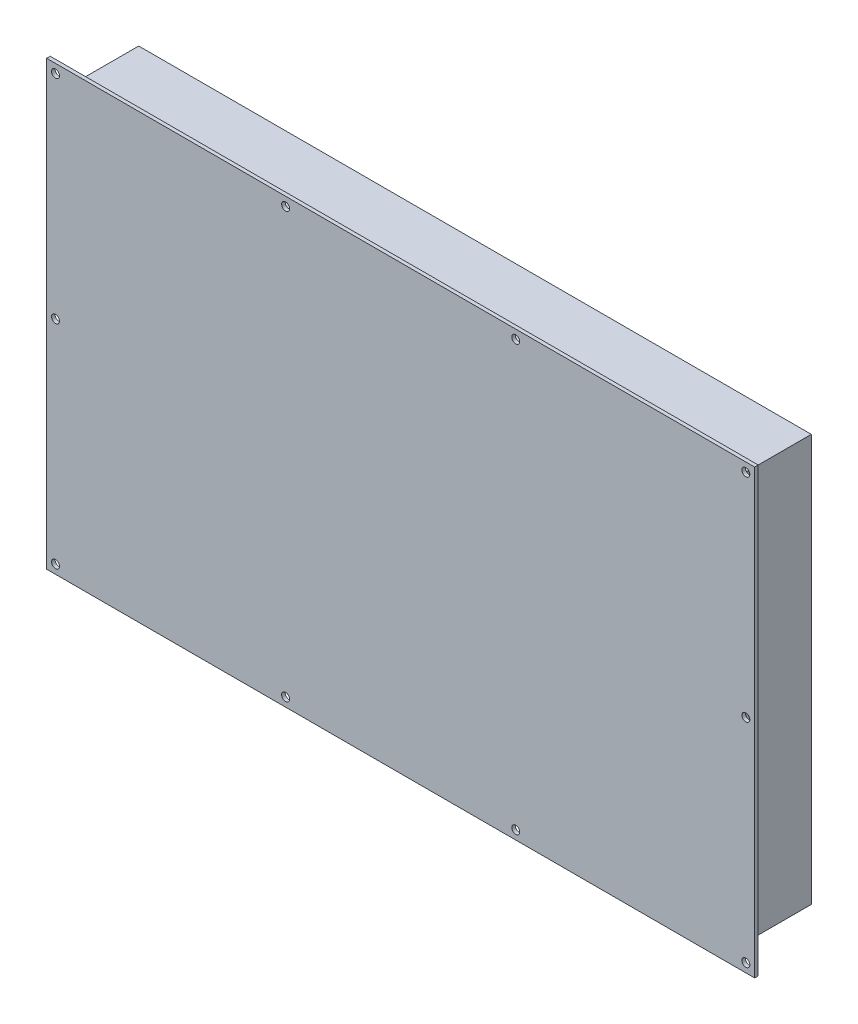
from build123d import *

# Parameters (mm, degrees)
IZIM1_W                     = 400
IZIM1_H                     = 250
Y_KSEKLIK_EKSTR_ZYON1_DEPTH = 2
KES_EKSTR_ZYON1_REACH       = 237.858
IZIM3_R                     = 2.25
IZIM4_W                     = 380
IZIM4_H                     = 230
Y_KSEKLIK_EKSTR_ZYON2_DEPTH = 40


with BuildPart() as part:
    # Çizim1 → Yükseklik-Ekstrüzyon1 (new body)
    with BuildSketch(Plane.XY):
        Rectangle(IZIM1_W, IZIM1_H)
    extrude(amount=Y_KSEKLIK_EKSTR_ZYON1_DEPTH)

    # Çizim3 → Kes-Ekstrüzyon1 (cut, up to next)
    with BuildSketch(Plane.XY.offset(2), mode=Mode.PRIVATE) as kes_ekstr_zyon1_sk1:
        with Locations((-195, 120)):
            Circle(IZIM3_R)
    kes_ekstr_zyon1_tool1 = extrude(kes_ekstr_zyon1_sk1.sketch, amount=-KES_EKSTR_ZYON1_REACH, mode=Mode.PRIVATE) & part.part
    # Çizim3 → Kes-Ekstrüzyon1 (cut, up to next)
    with BuildSketch(Plane.XY.offset(2), mode=Mode.PRIVATE) as kes_ekstr_zyon1_sk2:
        with Locations((-65, 120)):
            Circle(IZIM3_R)
    kes_ekstr_zyon1_tool2 = extrude(kes_ekstr_zyon1_sk2.sketch, amount=-KES_EKSTR_ZYON1_REACH, mode=Mode.PRIVATE) & part.part
    # Çizim3 → Kes-Ekstrüzyon1 (cut, up to next)
    with BuildSketch(Plane.XY.offset(2), mode=Mode.PRIVATE) as kes_ekstr_zyon1_sk3:
        with Locations((65, 120)):
            Circle(IZIM3_R)
    kes_ekstr_zyon1_tool3 = extrude(kes_ekstr_zyon1_sk3.sketch, amount=-KES_EKSTR_ZYON1_REACH, mode=Mode.PRIVATE) & part.part
    # Çizim3 → Kes-Ekstrüzyon1 (cut, up to next)
    with BuildSketch(Plane.XY.offset(2), mode=Mode.PRIVATE) as kes_ekstr_zyon1_sk4:
        with Locations((195, 120)):
            Circle(IZIM3_R)
    kes_ekstr_zyon1_tool4 = extrude(kes_ekstr_zyon1_sk4.sketch, amount=-KES_EKSTR_ZYON1_REACH, mode=Mode.PRIVATE) & part.part
    # Çizim3 → Kes-Ekstrüzyon1 (cut, up to next)
    with BuildSketch(Plane.XY.offset(2), mode=Mode.PRIVATE) as kes_ekstr_zyon1_sk5:
        with Locations(Location((-65, -120, 0), (0, 0, 180))):
            Circle(IZIM3_R)
    kes_ekstr_zyon1_tool5 = extrude(kes_ekstr_zyon1_sk5.sketch, amount=-KES_EKSTR_ZYON1_REACH, mode=Mode.PRIVATE) & part.part
    # Çizim3 → Kes-Ekstrüzyon1 (cut, up to next)
    with BuildSketch(Plane.XY.offset(2), mode=Mode.PRIVATE) as kes_ekstr_zyon1_sk6:
        with Locations(Location((65, -120, 0), (0, 0, 180))):
            Circle(IZIM3_R)
    kes_ekstr_zyon1_tool6 = extrude(kes_ekstr_zyon1_sk6.sketch, amount=-KES_EKSTR_ZYON1_REACH, mode=Mode.PRIVATE) & part.part
    # Çizim3 → Kes-Ekstrüzyon1 (cut, up to next)
    with BuildSketch(Plane.XY.offset(2), mode=Mode.PRIVATE) as kes_ekstr_zyon1_sk7:
        with Locations(Location((195, -120, 0), (0, 0, 180))):
            Circle(IZIM3_R)
    kes_ekstr_zyon1_tool7 = extrude(kes_ekstr_zyon1_sk7.sketch, amount=-KES_EKSTR_ZYON1_REACH, mode=Mode.PRIVATE) & part.part
    # Çizim3 → Kes-Ekstrüzyon1 (cut, up to next)
    with BuildSketch(Plane.XY.offset(2), mode=Mode.PRIVATE) as kes_ekstr_zyon1_sk8:
        with Locations(Location((-195, -120, 0), (0, 0, 180))):
            Circle(IZIM3_R)
    kes_ekstr_zyon1_tool8 = extrude(kes_ekstr_zyon1_sk8.sketch, amount=-KES_EKSTR_ZYON1_REACH, mode=Mode.PRIVATE) & part.part
    # Çizim3 → Kes-Ekstrüzyon1 (cut, up to next)
    with BuildSketch(Plane.XY.offset(2), mode=Mode.PRIVATE) as kes_ekstr_zyon1_sk9:
        with Locations(Location((-195, 0, 0), (0, 0, 180))):
            Circle(IZIM3_R)
    kes_ekstr_zyon1_tool9 = extrude(kes_ekstr_zyon1_sk9.sketch, amount=-KES_EKSTR_ZYON1_REACH, mode=Mode.PRIVATE) & part.part
    # Çizim3 → Kes-Ekstrüzyon1 (cut, up to next)
    with BuildSketch(Plane.XY.offset(2), mode=Mode.PRIVATE) as kes_ekstr_zyon1_sk10:
        with Locations(Location((195, 0, 0), (0, 0, 180))):
            Circle(IZIM3_R)
    kes_ekstr_zyon1_tool10 = extrude(kes_ekstr_zyon1_sk10.sketch, amount=-KES_EKSTR_ZYON1_REACH, mode=Mode.PRIVATE) & part.part
    add(kes_ekstr_zyon1_tool1.solids().sort_by_distance((-195, 120, 2))[0], mode=Mode.SUBTRACT)
    add(kes_ekstr_zyon1_tool2.solids().sort_by_distance((-65, 120, 2))[0], mode=Mode.SUBTRACT)
    add(kes_ekstr_zyon1_tool3.solids().sort_by_distance((65, 120, 2))[0], mode=Mode.SUBTRACT)
    add(kes_ekstr_zyon1_tool4.solids().sort_by_distance((195, 120, 2))[0], mode=Mode.SUBTRACT)
    add(kes_ekstr_zyon1_tool5.solids().sort_by_distance((-65, -120, 2))[0], mode=Mode.SUBTRACT)
    add(kes_ekstr_zyon1_tool6.solids().sort_by_distance((65, -120, 2))[0], mode=Mode.SUBTRACT)
    add(kes_ekstr_zyon1_tool7.solids().sort_by_distance((195, -120, 2))[0], mode=Mode.SUBTRACT)
    add(kes_ekstr_zyon1_tool8.solids().sort_by_distance((-195, -120, 2))[0], mode=Mode.SUBTRACT)
    add(kes_ekstr_zyon1_tool9.solids().sort_by_distance((-195, 0, 2))[0], mode=Mode.SUBTRACT)
    add(kes_ekstr_zyon1_tool10.solids().sort_by_distance((195, 0, 2))[0], mode=Mode.SUBTRACT)

    # Çizim4 → Yükseklik-Ekstrüzyon2 (add)
    with BuildSketch(Plane(origin=(0, 0, 0), x_dir=(-1, 0, 0), z_dir=(0, 0, -1))):
        Rectangle(IZIM4_W, IZIM4_H)
    extrude(amount=Y_KSEKLIK_EKSTR_ZYON2_DEPTH)


solid = part.part
